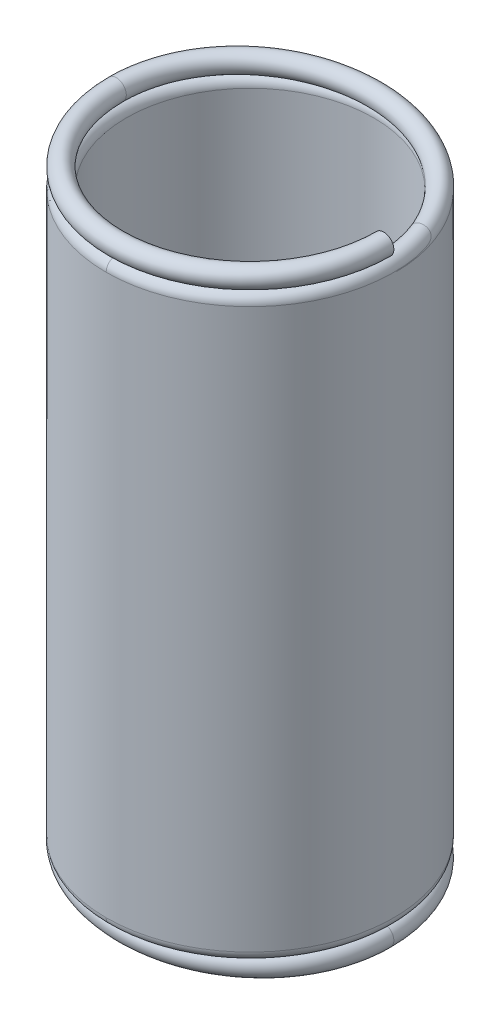
from build123d import *

# Parameters (mm, degrees)
SKETCH2_R      = 0.325
REVOLVE2_ANGLE = 180
SKETCH3_R      = 0.325
REVOLVE3_ANGLE = 180
SKETCH4_R      = 0.325
REVOLVE4_ANGLE = 180
SKETCH5_R      = 0.325
REVOLVE5_ANGLE = 180


with BuildPart() as part:
    # Sketch1 → Revolve1 (revolve)
    with BuildSketch(Plane.XY, mode=Mode.PRIVATE) as revolve1_sk:
        with BuildLine():
            Line((4, 9.035), (4, -9.035))
            ThreePointArc((4, -9.035), (4.325, -9.36), (4.65, -9.035))
            Line((4.65, -9.035), (4.65, 9.035))
            ThreePointArc((4.65, 9.035), (4.325, 9.36), (4, 9.035))
        make_face()
    revolve(revolve1_sk.sketch.rotate(Axis((0, -50, 0), (0, 1, 0)), 270), axis=Axis((0, -50, 0), (0, 1, 0)))

    # Sketch2 → Revolve2 (revolve)
    with BuildSketch(Plane.XY):
        with Locations((-4.325, 9.675)):
            Circle(SKETCH2_R)
    revolve(axis=Axis((0.33, 13.67, 0), (-0.07607944060615167, -0.997101759459412, 0)), revolution_arc=REVOLVE2_ANGLE)

    # Sketch3 → Revolve3 (revolve)
    with BuildSketch(Plane.XY):
        with Locations((-4.325, 9.675)):
            Circle(SKETCH3_R)
    revolve(axis=Axis((0, 50, 0), (0, 1, 0)), revolution_arc=REVOLVE3_ANGLE)

    # Sketch4 → Revolve4 (revolve)
    with BuildSketch(Plane.XY):
        with Locations((4.325, -9.675)):
            Circle(SKETCH4_R)
    revolve(axis=Axis((-0.33, -13.67, 0), (-0.07607944060615167, -0.997101759459412, 0)), revolution_arc=REVOLVE4_ANGLE)

    # Sketch5 → Revolve5 (revolve)
    with BuildSketch(Plane.XY):
        with Locations((4.325, -9.675)):
            Circle(SKETCH5_R)
    revolve(axis=Axis((0, -50, 0), (0, 1, 0)), revolution_arc=REVOLVE5_ANGLE)


solid = part.part
